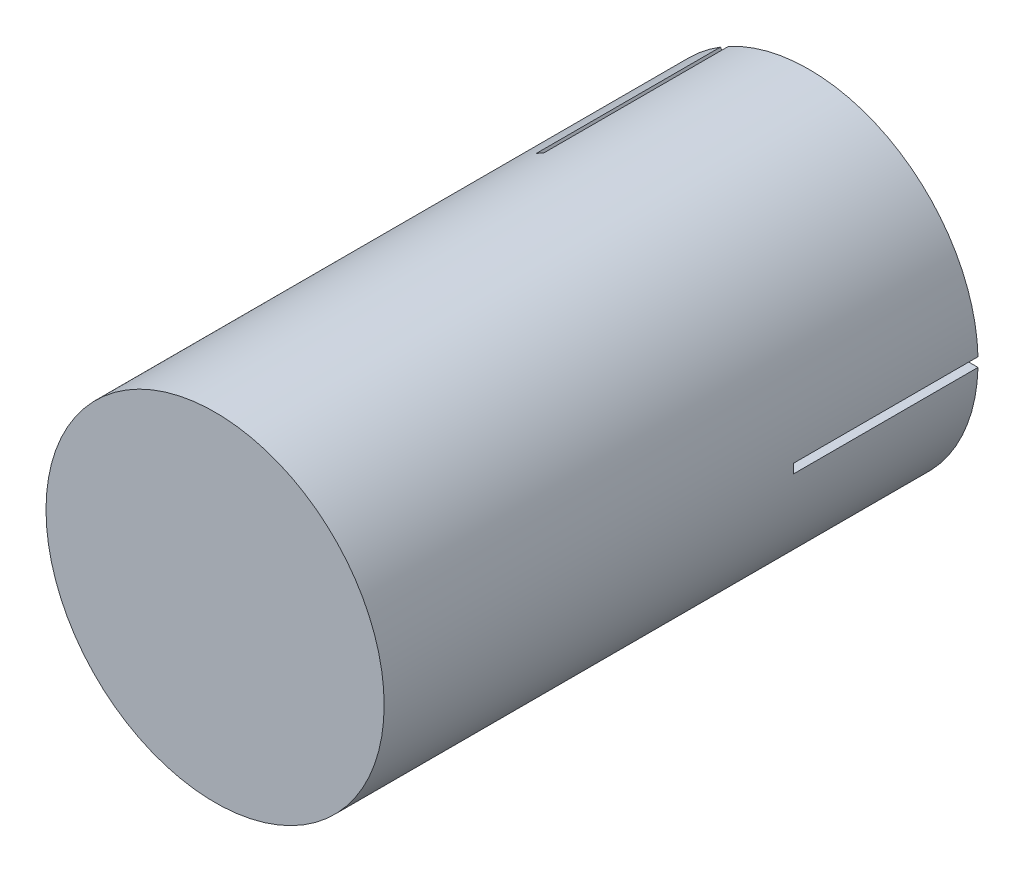
from build123d import *

# Parameters (mm, degrees)
SKETCH_1_R          = 55
EXTRUDE_1_DEPTH     = 190
SKETCH_2_R          = 51.8
CUT_EXTRUDE_1_DEPTH = 186.8
SKETCH_3_R          = 15
CUT_EXTRUDE_2_DEPTH = 10
SKETCH_4_R          = 18.2
SKETCH_4_R_2        = 15
EXTRUDE_2_DEPTH     = 188
SKETCH_5_R          = 55
EXTRUDE_5_DEPTH     = 3.2
EXTRUDE_6_DEPTH     = 1.5
EXTRUDE_START       = -63.2
EXTRUDE_7_DEPTH     = 63.2
CUT_EXTRUDE_START   = -60
CUT_EXTRUDE_4_DEPTH = 60
SKETCH_12_R         = 138.367390037
SKETCH_12_R_2       = 55
CUT_EXTRUDE_5_DEPTH = 135
CUT_EXTRUDE_6_DEPTH = 10


with BuildPart() as part:
    # 草图1 → 凸台-拉伸1 (new body)
    with BuildSketch(Plane.XY):
        Circle(SKETCH_1_R)
    extrude(amount=EXTRUDE_1_DEPTH)

    # 草图2 → 切除-拉伸1 (cut)
    with BuildSketch(Plane.XY.offset(190)):
        Circle(SKETCH_2_R)
    extrude(amount=-CUT_EXTRUDE_1_DEPTH, mode=Mode.SUBTRACT)

    # 草图3 → 切除-拉伸2 (cut)
    with BuildSketch(Plane(origin=(0, 0, 0), x_dir=(-1, 0, 0), z_dir=(0, 0, -1))):
        Circle(SKETCH_3_R)
    extrude(amount=-CUT_EXTRUDE_2_DEPTH, mode=Mode.SUBTRACT)

    # 草图4 → 凸台-拉伸2 (add)
    with BuildSketch(Plane.XY.offset(3.2)):
        Circle(SKETCH_4_R)
        with Locations(Location((0, 0, 0), (0, 0, 180))):
            Circle(SKETCH_4_R_2, mode=Mode.SUBTRACT)
    extrude(amount=EXTRUDE_2_DEPTH)

    # 草图5 → 凸台-拉伸5 (add)
    with BuildSketch(Plane.XY.offset(190)):
        Circle(SKETCH_5_R)
    extrude(amount=EXTRUDE_5_DEPTH)

    # 草图8 → 凸台-拉伸6 (add, symmetric)
    with BuildSketch(Plane(origin=(0, 0, 0), x_dir=(-1, 0, 0), z_dir=(0, 1, 0))):
        Polygon((-55, 90), (-135, 65), (-135, -15), (-55, 0), (-53, 0), (-53, 90), align=None)
    extrude(amount=EXTRUDE_6_DEPTH, both=True)

    # 草图9 → 凸台-拉伸7 (add)
    with BuildSketch(Plane(origin=(0, 0, 0), x_dir=(-1, 0, 0), z_dir=(0, 0, -1)).offset(EXTRUDE_START)):
        with BuildLine():
            Line((-51.178511116, 8), (-47.866376508, 9.5))
            Line((-47.866376508, 9.5), (-44.599439458, 9.5))
            ThreePointArc((-44.599439458, 9.5), (-45.6, 0), (-44.599439458, -9.5))
            Line((-44.599439458, -9.5), (-47.866376508, -9.5))
            Line((-47.866376508, -9.5), (-51.178511116, -8))
            ThreePointArc((-51.178511116, -8), (-51.8, 0), (-51.178511116, 8))
        make_face()
        with BuildLine():
            Line((32.517458788, 40.321890754), (32.16042959, 36.703498043))
            Line((32.16042959, 36.703498043), (30.526961065, 33.874247565))
            ThreePointArc((30.526961065, 33.874247565), (22.8, 39.490758413), (14.072478393, 43.374247565))
            Line((14.072478393, 43.374247565), (15.705946918, 46.203498043))
            Line((15.705946918, 46.203498043), (18.661052327, 48.321890754))
            ThreePointArc((18.661052327, 48.321890754), (25.9, 44.860115916), (32.517458788, 40.321890754))
        make_face()
        with BuildLine():
            Line((18.661052327, -48.321890754), (15.705946918, -46.203498043))
            Line((15.705946918, -46.203498043), (14.072478393, -43.374247565))
            ThreePointArc((14.072478393, -43.374247565), (22.8, -39.490758413), (30.526961065, -33.874247565))
            Line((30.526961065, -33.874247565), (32.16042959, -36.703498043))
            Line((32.16042959, -36.703498043), (32.517458788, -40.321890754))
            ThreePointArc((32.517458788, -40.321890754), (25.9, -44.860115916), (18.661052327, -48.321890754))
        make_face()
    extrude(amount=EXTRUDE_7_DEPTH)

    # 草图11 → 切除-拉伸4 (cut)
    with BuildSketch(Plane(origin=(0, 0, 0), x_dir=(-1, 0, 0), z_dir=(0, 0, -1)).offset(CUT_EXTRUDE_START)):
        with BuildLine():
            Line((-65.998357279, 1.5), (-51.778277298, 1.5))
            ThreePointArc((-51.778277298, 1.5), (-51.697827643, 3.251863624), (-51.558122541, 5))
            Line((-51.558122541, 5), (-48.29534139, 7))
            ThreePointArc((-48.29534139, 7), (-48.8, 0), (-48.29534139, -7))
            Line((-48.29534139, -7), (-51.558122541, -5))
            ThreePointArc((-51.558122541, -5), (-51.697827643, -3.251863624), (-51.778277298, -1.5))
            Line((-51.778277298, -1.5), (-65.998357279, -1.5))
            Line((-65.998357279, -1.5), (-65.998357279, 1.5))
        make_face()
        with BuildLine():
            Line((34.298216745, 56.406254012), (31.700140534, 57.906254012))
            Line((31.700140534, 57.906254012), (24.590100544, 45.591303505))
            ThreePointArc((24.590100544, 45.591303505), (23.032717313, 46.397563871), (21.448934252, 47.150643892))
            Line((21.448934252, 47.150643892), (18.085492869, 45.324992528))
            ThreePointArc((18.085492869, 45.324992528), (24.4, 42.262039705), (30.209848522, 38.324992528))
            Line((30.209848522, 38.324992528), (30.10918829, 42.150643892))
            ThreePointArc((30.10918829, 42.150643892), (28.665110329, 43.145700247), (27.188176755, 44.091303505))
            Line((27.188176755, 44.091303505), (34.298216745, 56.406254012))
        make_face()
        with BuildLine():
            Line((31.700140534, -57.906254012), (34.298216745, -56.406254012))
            Line((34.298216745, -56.406254012), (27.188176755, -44.091303505))
            ThreePointArc((27.188176755, -44.091303505), (28.665110329, -43.145700247), (30.10918829, -42.150643892))
            Line((30.10918829, -42.150643892), (30.209848522, -38.324992528))
            ThreePointArc((30.209848522, -38.324992528), (24.4, -42.262039705), (18.085492869, -45.324992528))
            Line((18.085492869, -45.324992528), (21.448934252, -47.150643892))
            ThreePointArc((21.448934252, -47.150643892), (23.032717313, -46.397563871), (24.590100544, -45.591303505))
            Line((24.590100544, -45.591303505), (31.700140534, -57.906254012))
        make_face()
    extrude(amount=CUT_EXTRUDE_4_DEPTH, mode=Mode.SUBTRACT)

    # 草图12 → 切除-拉伸5 (cut, symmetric)
    with BuildSketch(Plane(origin=(0, 0, 0), x_dir=(-1, 0, 0), z_dir=(0, 0, -1))):
        Circle(SKETCH_12_R)
        with Locations(Location((0, 0, 0), (0, 0, 58.437194054))):
            Circle(SKETCH_12_R_2, mode=Mode.SUBTRACT)
    extrude(amount=CUT_EXTRUDE_5_DEPTH, both=True, mode=Mode.SUBTRACT)

    # 草图13 → 切除-拉伸6 (cut)
    with BuildSketch(Plane(origin=(0, 0, 0), x_dir=(-1, 0, 0), z_dir=(0, 0, -1))):
        with BuildLine():
            Line((4, 27.110883423), (4, 36.331804249))
            ThreePointArc((4, 36.331804249), (5.08985638, 38.645103052), (7.567567568, 39.277626215))
            ThreePointArc((7.567567568, 39.277626215), (28.284271247, 28.284271247), (39.277626215, 7.567567568))
            ThreePointArc((39.277626215, 7.567567568), (38.645103052, 5.08985638), (36.331804249, 4))
            Line((36.331804249, 4), (27.110883423, 4))
            ThreePointArc((27.110883423, 4), (25.273766116, 4.628291755), (24.206145914, 6.25))
            ThreePointArc((24.206145914, 6.25), (17.67766953, 17.67766953), (6.25, 24.206145914))
            ThreePointArc((6.25, 24.206145914), (4.628291755, 25.273766116), (4, 27.110883423))
        make_face()
        with BuildLine():
            Line((-4, 27.110883423), (-4, 36.331804249))
            ThreePointArc((-4, 36.331804249), (-5.08985638, 38.645103052), (-7.567567568, 39.277626215))
            ThreePointArc((-7.567567568, 39.277626215), (-28.284271247, 28.284271247), (-39.277626215, 7.567567568))
            ThreePointArc((-39.277626215, 7.567567568), (-38.645103052, 5.08985638), (-36.331804249, 4))
            Line((-36.331804249, 4), (-27.110883423, 4))
            ThreePointArc((-27.110883423, 4), (-25.273766116, 4.628291755), (-24.206145914, 6.25))
            ThreePointArc((-24.206145914, 6.25), (-17.67766953, 17.67766953), (-6.25, 24.206145914))
            ThreePointArc((-6.25, 24.206145914), (-4.628291755, 25.273766116), (-4, 27.110883423))
        make_face()
        with BuildLine():
            Line((27.110883423, -4), (36.331804249, -4))
            ThreePointArc((36.331804249, -4), (38.645103052, -5.08985638), (39.277626215, -7.567567568))
            ThreePointArc((39.277626215, -7.567567568), (28.284271247, -28.284271247), (7.567567568, -39.277626215))
            ThreePointArc((7.567567568, -39.277626215), (5.08985638, -38.645103052), (4, -36.331804249))
            Line((4, -36.331804249), (4, -27.110883423))
            ThreePointArc((4, -27.110883423), (4.628291755, -25.273766116), (6.25, -24.206145914))
            ThreePointArc((6.25, -24.206145914), (17.67766953, -17.67766953), (24.206145914, -6.25))
            ThreePointArc((24.206145914, -6.25), (25.273766116, -4.628291755), (27.110883423, -4))
        make_face()
        with BuildLine():
            Line((-4, -27.110883423), (-4, -36.331804249))
            ThreePointArc((-4, -36.331804249), (-5.08985638, -38.645103052), (-7.567567568, -39.277626215))
            ThreePointArc((-7.567567568, -39.277626215), (-28.284271247, -28.284271247), (-39.277626215, -7.567567568))
            ThreePointArc((-39.277626215, -7.567567568), (-38.645103052, -5.08985638), (-36.331804249, -4))
            Line((-36.331804249, -4), (-27.110883423, -4))
            ThreePointArc((-27.110883423, -4), (-25.273766116, -4.628291755), (-24.206145914, -6.25))
            ThreePointArc((-24.206145914, -6.25), (-17.67766953, -17.67766953), (-6.25, -24.206145914))
            ThreePointArc((-6.25, -24.206145914), (-4.628291755, -25.273766116), (-4, -27.110883423))
        make_face()
    extrude(amount=-CUT_EXTRUDE_6_DEPTH, mode=Mode.SUBTRACT)


solid = part.part
